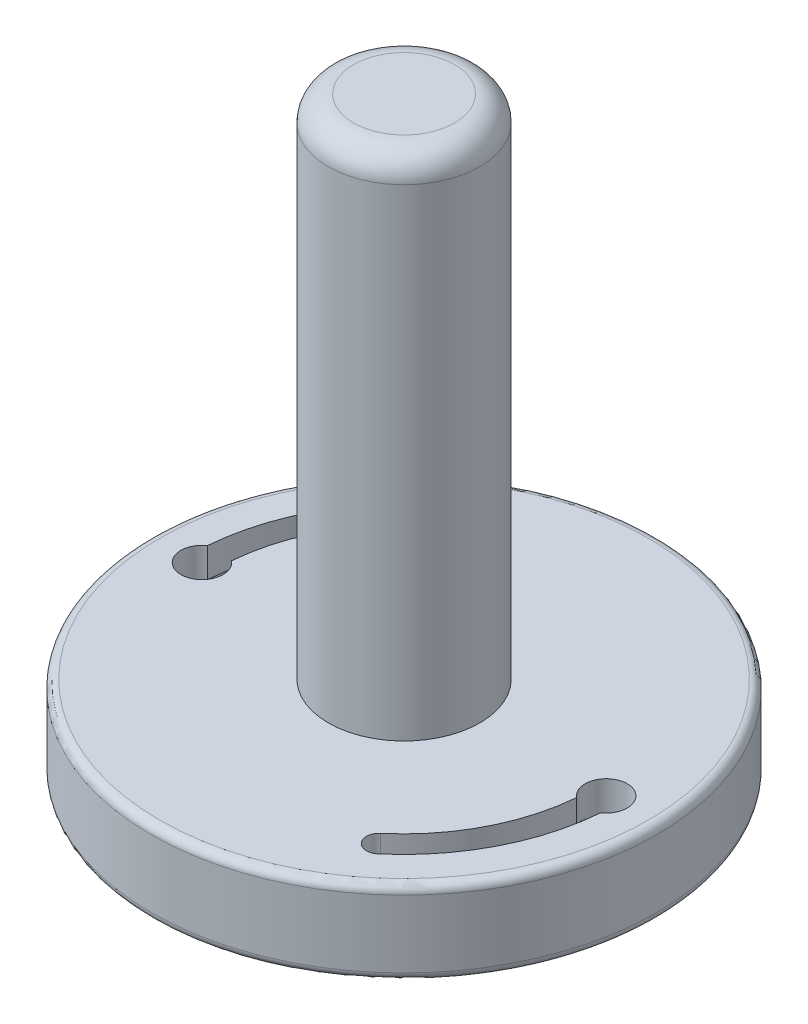
from build123d import *

# Parameters (mm, degrees)
SKETCH1_R           = 38.1
BOSS_EXTRUDE1_DEPTH = 12.7
SKETCH2_R           = 11.43
BOSS_EXTRUDE2_DEPTH = 76.454
FILLET1_R           = 1.27
FILLET2_R           = 1.27
FILLET3_R           = 3.81
CUT_EXTRUDE1_DEPTH  = 4.445
CUT_EXTRUDE2_DEPTH  = 3.175


with BuildPart() as part:
    # Sketch1 → Boss-Extrude1 (new body)
    with BuildSketch(Plane(origin=(0, 0, 0), x_dir=(1, 0, 0), z_dir=(0, 1, 0))):
        with Locations(Location((0, 0, 0), (0, 0, 270))):
            Circle(SKETCH1_R)
    extrude(amount=BOSS_EXTRUDE1_DEPTH)

    # Sketch2 → Boss-Extrude2 (add)
    with BuildSketch(Plane(origin=(0, 12.7, 0), x_dir=(1, 0, 0), z_dir=(0, 1, 0))):
        with Locations(Location((0, 0, 0), (0, 0, 270))):
            Circle(SKETCH2_R)
    extrude(amount=BOSS_EXTRUDE2_DEPTH)

    # Fillet1
    fillet1_edges = [part.edges().sort_by_distance(p)[0] for p in [
        (0, 12.7, -38.1),
    ]]
    fillet(fillet1_edges, radius=FILLET1_R)

    # Fillet2
    fillet2_edges = [part.edges().sort_by_distance(p)[0] for p in [
        (0, 0, -38.1),
    ]]
    fillet(fillet2_edges, radius=FILLET2_R)

    # Fillet3
    fillet3_edges = [part.edges().sort_by_distance(p)[0] for p in [
        (0, 89.154, -11.43),
    ]]
    fillet(fillet3_edges, radius=FILLET3_R)

    # Sketch4 → Cut-Extrude1 (cut)
    with BuildSketch(Plane(origin=(0, 12.7, 0), x_dir=(1, 0, 0), z_dir=(0, 1, 0))):
        with BuildLine():
            ThreePointArc((-32.279166667, 2.616032168), (-30.612356486, -3.172240023), (-28.469166667, 2.457066199))
            ThreePointArc((-28.469166667, 2.457066199), (-25.354072576, 13.179591374), (-18.367655947, 21.889719962))
            ThreePointArc((-18.367655947, 21.889719962), (-18.132851679, 24.573545023), (-20.81667674, 24.80834929))
            ThreePointArc((-20.81667674, 24.80834929), (-28.773544821, 14.861740929), (-32.279166667, 2.616032168))
        make_face()
        with BuildLine():
            ThreePointArc((32.279166667, -2.616032168), (30.612356486, 3.172240023), (28.469166667, -2.457066199))
            ThreePointArc((28.469166667, -2.457066199), (25.354072576, -13.179591374), (18.367655947, -21.889719962))
            ThreePointArc((18.367655947, -21.889719962), (18.132851679, -24.573545023), (20.81667674, -24.80834929))
            ThreePointArc((20.81667674, -24.80834929), (28.773544821, -14.861740929), (32.279166667, -2.616032168))
        make_face()
    extrude(amount=-CUT_EXTRUDE1_DEPTH, mode=Mode.SUBTRACT)

    # Sketch5 → Cut-Extrude2 (cut)
    with BuildSketch(Plane(origin=(0, 8.255, 0), x_dir=(1, 0, 0), z_dir=(0, 1, 0))):
        with BuildLine():
            ThreePointArc((-21.633017004, 25.781225733), (-30.501788573, 14.223217599), (-33.655, 0))
            ThreePointArc((-33.655, 0), (-30.48, -3.175), (-27.305, 0))
            ThreePointArc((-27.305, 0), (-24.746734125, 11.539591637), (-17.551315682, 20.916843519))
            ThreePointArc((-17.551315682, 20.916843519), (-17.159975236, 25.389885287), (-21.633017004, 25.781225733))
        make_face()
        with BuildLine():
            ThreePointArc((33.655, 0), (30.48, 3.175), (27.305, 0))
            ThreePointArc((27.305, 0), (24.746734125, -11.539591637), (17.551315682, -20.916843519))
            ThreePointArc((17.551315682, -20.916843519), (17.159975236, -25.389885287), (21.633017004, -25.781225733))
            ThreePointArc((21.633017004, -25.781225733), (30.501788573, -14.223217599), (33.655, 0))
        make_face()
    extrude(amount=-CUT_EXTRUDE2_DEPTH, mode=Mode.SUBTRACT)


solid = part.part
